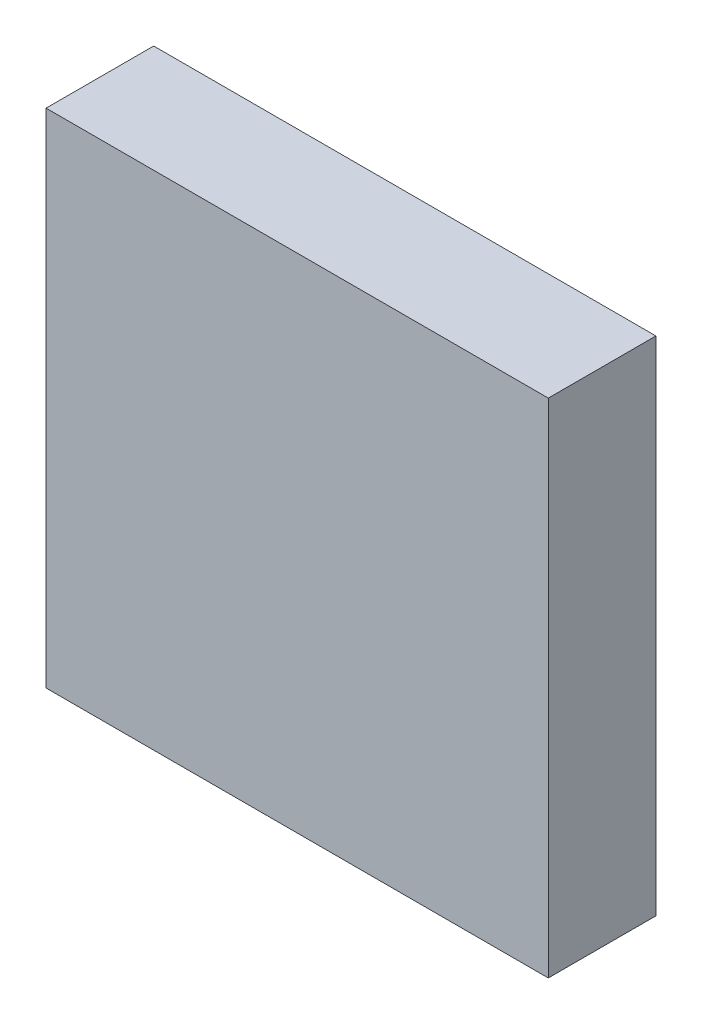
from build123d import *

# Parameters (mm, degrees)
SKETCH1_W           = 14
SKETCH1_H           = 14
BOSS_EXTRUDE1_DEPTH = 3


with BuildPart() as part:
    # Sketch1 → Boss-Extrude1 (new body)
    with BuildSketch(Plane.XY):
        Rectangle(SKETCH1_W, SKETCH1_H)
    extrude(amount=BOSS_EXTRUDE1_DEPTH)


solid = part.part
